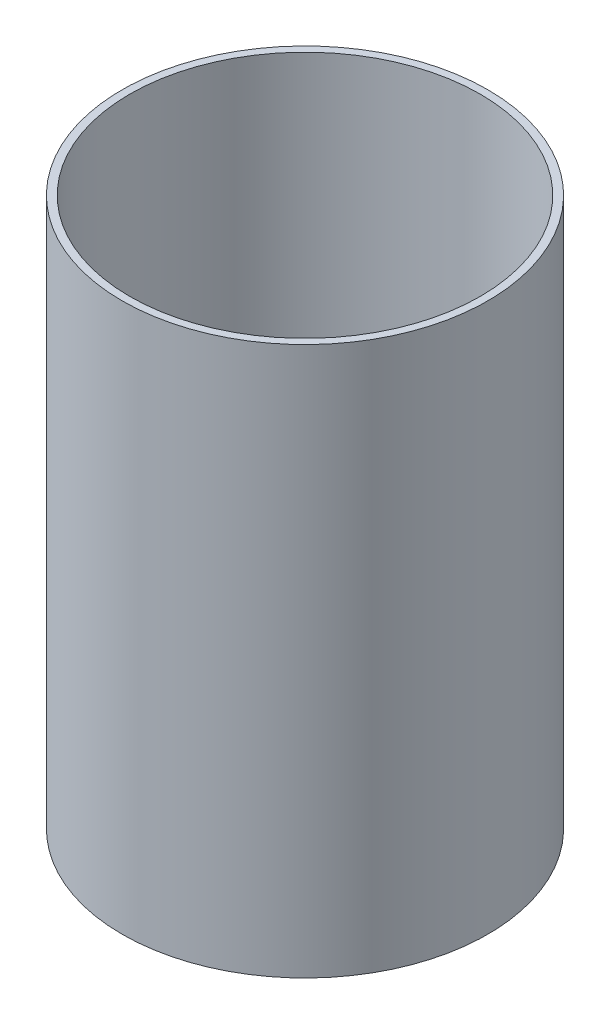
from build123d import *

# Parameters (mm, degrees)
SKETCH1_R           = 152.4
SKETCH1_R_2         = 146.05
BOSS_EXTRUDE1_DEPTH = 457.2


with BuildPart() as part:
    # Sketch1 → Boss-Extrude1 (new body)
    with BuildSketch(Plane(origin=(0, 0, 0), x_dir=(1, 0, 0), z_dir=(0, 1, 0))):
        with Locations(Location((0, 0, 0), (0, 0, 270))):
            Circle(SKETCH1_R)
        with Locations(Location((0, 0, 0), (0, 0, 270))):
            Circle(SKETCH1_R_2, mode=Mode.SUBTRACT)
    extrude(amount=BOSS_EXTRUDE1_DEPTH)


solid = part.part
